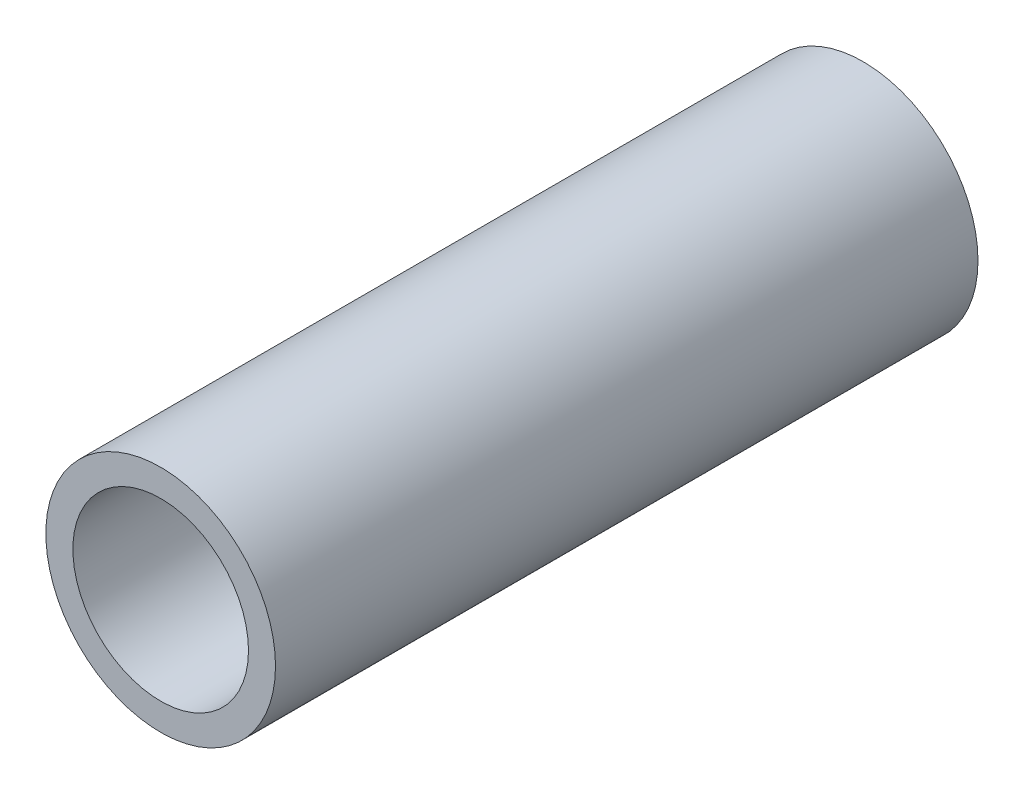
from build123d import *

# Parameters (mm, degrees)
ESQUISSE1_R          = 8.5
ESQUISSE1_R_2        = 6.5
BASE_EXTRUSION_DEPTH = 52


with BuildPart() as part:
    # Esquisse1 → Base-Extrusion (new body)
    with BuildSketch(Plane.XY):
        Circle(ESQUISSE1_R)
        Circle(ESQUISSE1_R_2, mode=Mode.SUBTRACT)
    extrude(amount=BASE_EXTRUSION_DEPTH)


solid = part.part
